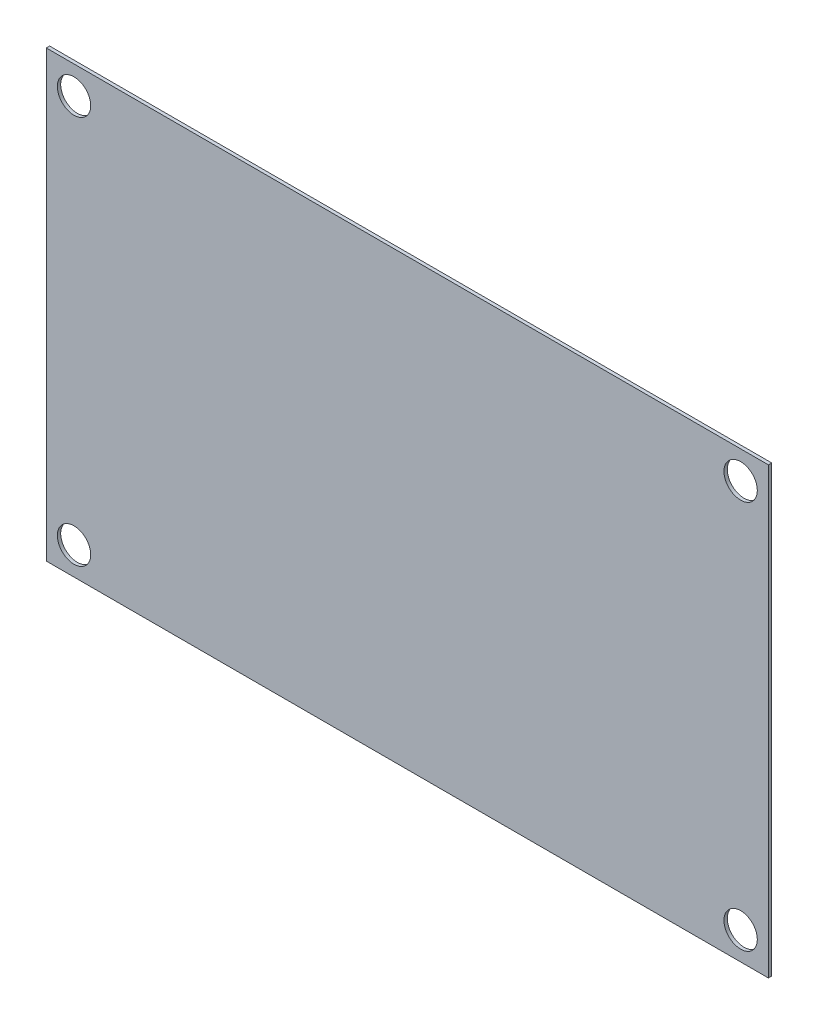
from build123d import *

# Parameters (mm, degrees)
SKETCH1_W           = 65
SKETCH1_H           = 40
SKETCH1_R           = 1.5
BOSS_EXTRUDE1_DEPTH = 0.3


with BuildPart() as part:
    # Sketch1 → Boss-Extrude1 (new body)
    with BuildSketch(Plane.XY):
        Rectangle(SKETCH1_W, SKETCH1_H)
        with Locations((-30, 17.5)):
            Circle(SKETCH1_R, mode=Mode.SUBTRACT)
        with Locations((-30, -17.5)):
            Circle(SKETCH1_R, mode=Mode.SUBTRACT)
        with Locations((30, -17.5)):
            Circle(SKETCH1_R, mode=Mode.SUBTRACT)
        with Locations((30, 17.5)):
            Circle(SKETCH1_R, mode=Mode.SUBTRACT)
    extrude(amount=BOSS_EXTRUDE1_DEPTH)


solid = part.part
